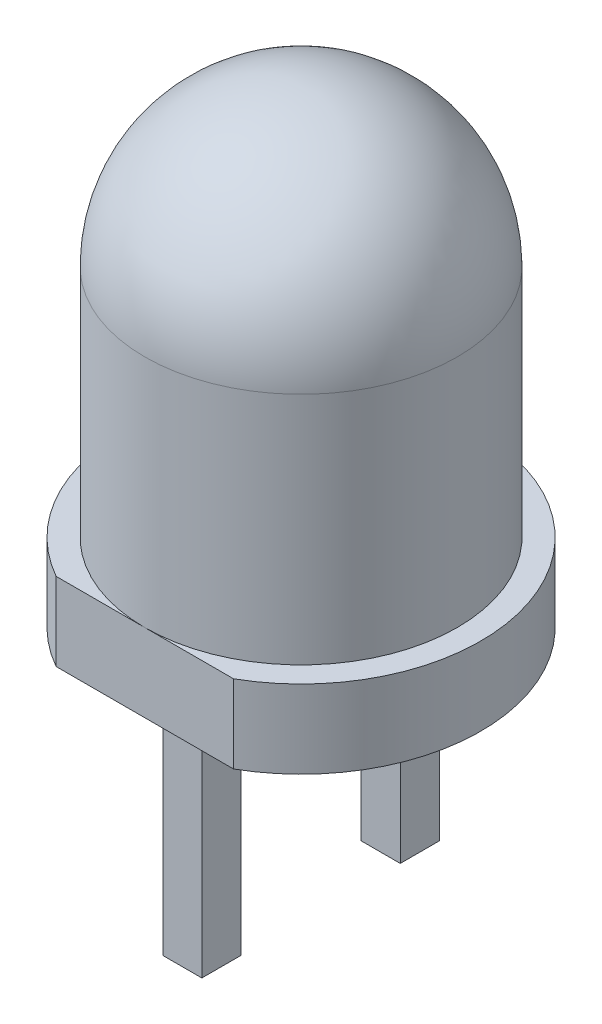
from build123d import *

# Parameters (mm, degrees)
SKETCH_1_R          = 2.3
EXTRUDE_1_DEPTH     = 1
SKETCH_2_R          = 2
EXTRUDE_2_DEPTH     = 5
SKETCH_3_W          = 0.5
SKETCH_3_H          = 0.5
EXTRUDE_3_DEPTH     = 3
SKETCH_4_W          = 9.434244616
SKETCH_4_H          = 19.451997256
CUT_EXTRUDE_1_DEPTH = 3
FILLET_1_R          = 2


with BuildPart() as part:
    # Эскиз1 → Бобышка-Вытянуть1 (new body)
    with BuildSketch(Plane(origin=(0, 0, 0), x_dir=(1, 0, 0), z_dir=(0, 1, 0))):
        with Locations(Location((0, 0, 0), (0, 0, 270))):
            Circle(SKETCH_1_R)
    extrude(amount=EXTRUDE_1_DEPTH)

    # Эскиз2 → Бобышка-Вытянуть2 (add)
    with BuildSketch(Plane(origin=(0, 1, 0), x_dir=(1, 0, 0), z_dir=(0, 1, 0))):
        with Locations(Location((0, 0, 0), (0, 0, 270))):
            Circle(SKETCH_2_R)
    extrude(amount=EXTRUDE_2_DEPTH)

    # Эскиз3 → Бобышка-Вытянуть3 (add)
    with BuildSketch(Plane.XZ):
        with Locations((0, 1.27)):
            Rectangle(SKETCH_3_W, SKETCH_3_H)
    extrude_3 = extrude(amount=EXTRUDE_3_DEPTH)

    # Зеркальное отражение1: Бобышка-Вытянуть3 across plane
    add(extrude_3.mirror(Plane(origin=(0, 0, 0), x_dir=(1, 0, 0), z_dir=(0, 0, -1))))

    # Эскиз4 → Вырез-Вытянуть1 (cut)
    with BuildSketch(Plane.XY.offset(2)):
        Rectangle(SKETCH_4_W, SKETCH_4_H)
    extrude(amount=CUT_EXTRUDE_1_DEPTH, mode=Mode.SUBTRACT)

    # Скругление1
    fillet_1_edges = [part.edges().sort_by_distance(p)[0] for p in [
        (0, 6, -2),
    ]]
    fillet(fillet_1_edges, radius=FILLET_1_R)


solid = part.part
